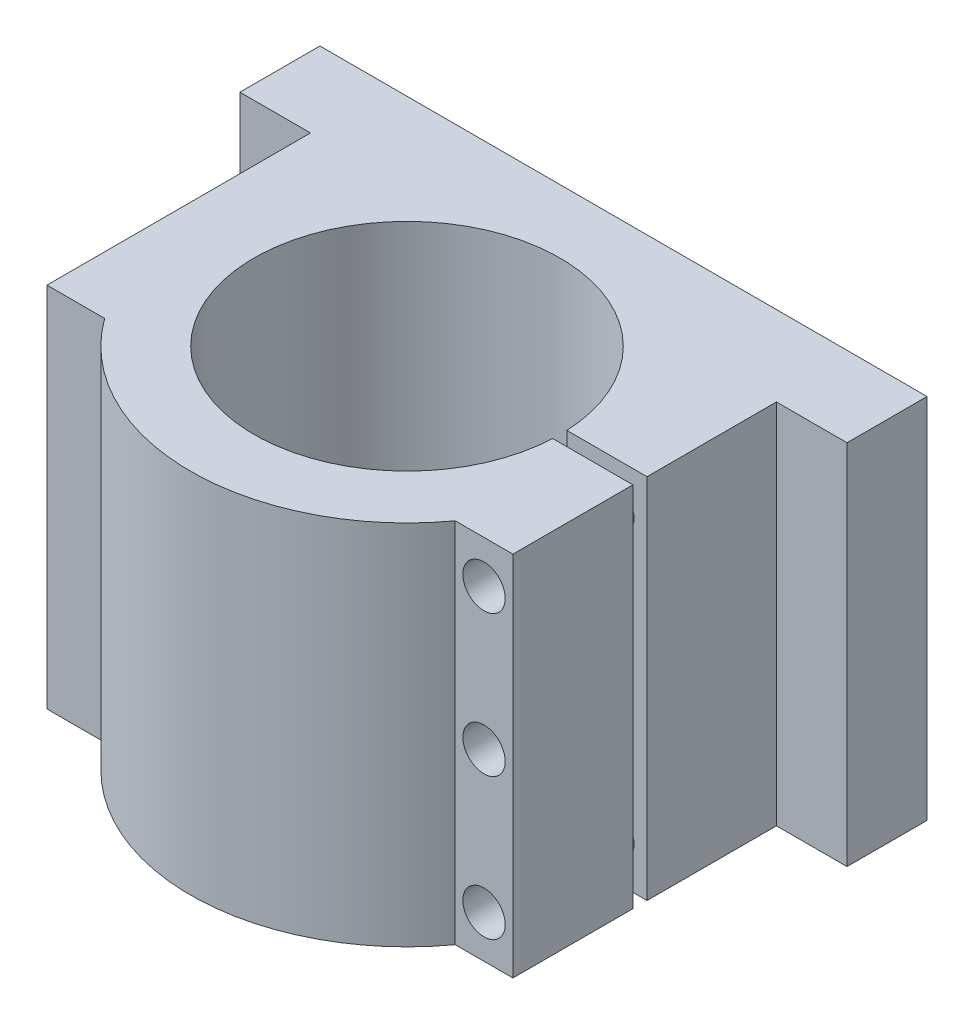
from build123d import *

# Parameters (mm, degrees)
BOSS_EXTRUDE1_DEPTH          = 78
F_9_0_9_DIAMETER_HOLE1_D     = 9
F_9_0_9_DIAMETER_HOLE1_DEPTH = 25.5
M8_TAPPED_HOLE1_D            = 6.8
M8_TAPPED_HOLE1_DEPTH        = 19.75
M8_TAPPED_HOLE1_TIP          = 2.042926105


with BuildPart() as part:
    # Sketch1 → Boss-Extrude1 (new body)
    with BuildSketch(Plane(origin=(0, 0, 0), x_dir=(1, 0, 0), z_dir=(0, 1, 0))):
        with BuildLine():
            Line((-64.5, 0), (-64.5, -17))
            Line((-64.5, -17), (-49.5, -17))
            Line((-49.5, -17), (-49.5, -73))
            Line((-49.5, -73), (-37.242448899, -73))
            ThreePointArc((-37.242448899, -73), (0, -92), (37.242448899, -73))
            Line((37.242448899, -73), (49.5, -73))
            Line((49.5, -73), (49.5, -47.5))
            Line((49.5, -47.5), (32.465366161, -47.5))
            ThreePointArc((32.465366161, -47.5), (-32.5, -46), (32.465366161, -44.5))
            Line((32.465366161, -44.5), (49.5, -44.5))
            Line((49.5, -44.5), (49.5, -17))
            Line((49.5, -17), (64.5, -17))
            Line((64.5, -17), (64.5, 0))
            Line((64.5, 0), (0, 0))
            Line((0, 0), (-64.5, 0))
        make_face()
    extrude(amount=BOSS_EXTRUDE1_DEPTH)

    # Ø9.0 (9) Diameter Hole1
    with Locations(Plane.XY.offset(73)):
        with Locations((43.37122445, 69), (43.37122445, 39), (43.37122445, 9)):
            Hole(F_9_0_9_DIAMETER_HOLE1_D / 2, depth=F_9_0_9_DIAMETER_HOLE1_DEPTH)

    # M8 Tapped Hole1
    with Locations(Plane.XY.offset(44.5)):
        with Locations((43.37122445, 69), (43.37122445, 9)):
            Hole(M8_TAPPED_HOLE1_D / 2, depth=M8_TAPPED_HOLE1_DEPTH)
            with Locations((0, 0, -(M8_TAPPED_HOLE1_DEPTH + M8_TAPPED_HOLE1_TIP / 2))):  # 118° drill point
                Cone(0, M8_TAPPED_HOLE1_D / 2, M8_TAPPED_HOLE1_TIP, mode=Mode.SUBTRACT)


solid = part.part
